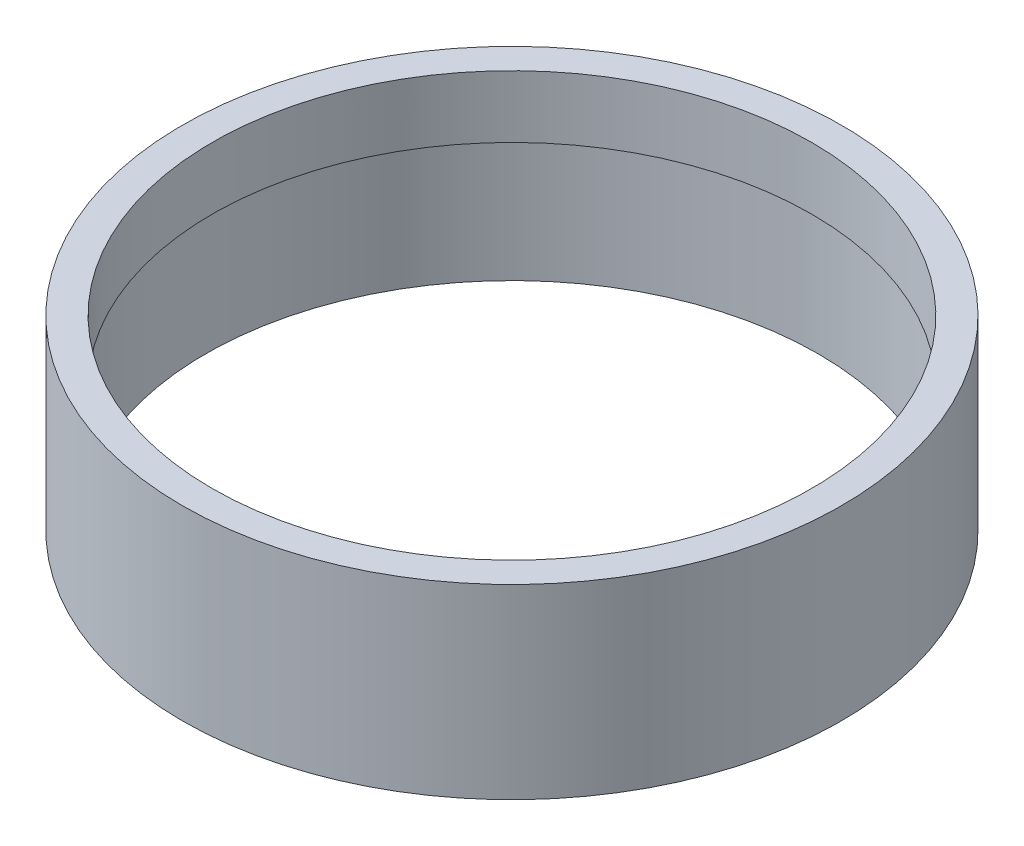
from build123d import *

# Parameters (mm, degrees)
SKETCH1_R           = 26.525
SKETCH1_R_2         = 24.125
BOSS_EXTRUDE1_DEPTH = 15
SKETCH2_R           = 24.65
CUT_EXTRUDE1_DEPTH  = 10


with BuildPart() as part:
    # Sketch1 → Boss-Extrude1 (new body)
    with BuildSketch(Plane(origin=(0, 0, 0), x_dir=(1, 0, 0), z_dir=(0, 1, 0))):
        with Locations(Location((0, 0, 0), (0, 0, 270))):
            Circle(SKETCH1_R)
        with Locations(Location((0, 0, 0), (0, 0, 270))):
            Circle(SKETCH1_R_2, mode=Mode.SUBTRACT)
    extrude(amount=BOSS_EXTRUDE1_DEPTH)

    # Sketch2 → Cut-Extrude1 (cut)
    with BuildSketch(Plane.XZ):
        with Locations(Location((0, 0, 0), (0, 0, 270))):
            Circle(SKETCH2_R)
    extrude(amount=-CUT_EXTRUDE1_DEPTH, mode=Mode.SUBTRACT)


solid = part.part
